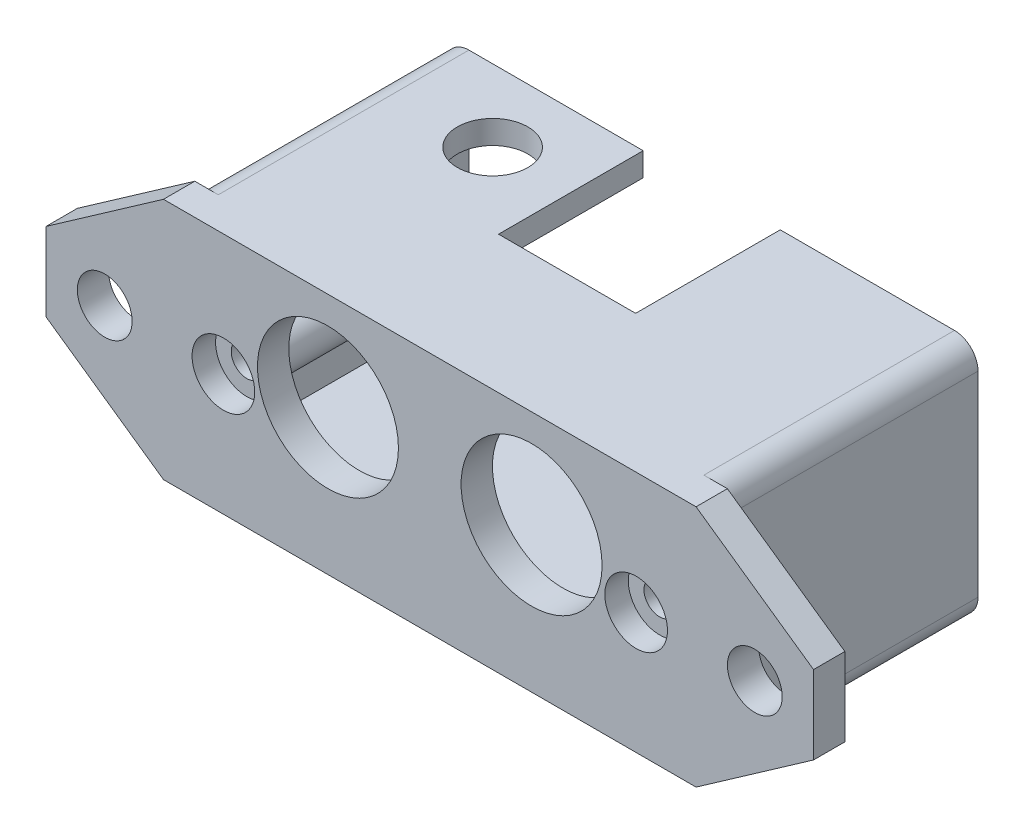
from build123d import *

# Parameters (mm, degrees)
CROQUIS1_R                 = 2
CROQUIS1_R_2               = 3.5
CROQUIS1_R_3               = 9
SALIENTE_EXTRUIR1_DEPTH    = 4
SALIENTE_EXTRUIR2_START    = -12
CROQUIS3_R                 = 3
CROQUIS3_R_2               = 2
SALIENTE_EXTRUIR2_DEPTH    = 12
CROQUIS4_W                 = 62
CROQUIS4_H                 = 25
SALIENTE_EXTRUIR3_DEPTH    = 32
CORTAR_EXTRUIR1_DEPTH      = 10
CORTAR_EXTRUIR1_DEPTH_BACK = 18
CROQUIS5_R                 = 4.5
CROQUIS5_W                 = 17.5
CROQUIS5_H                 = 18.482527597
CORTAR_EXTRUIR2_START      = -3
CROQUIS6_R                 = 4
CROQUIS6_R_2               = 2
CORTAR_EXTRUIR2_DEPTH      = 3


with BuildPart() as part:
    # Croquis1 → Saliente-Extruir1 (new body)
    with BuildSketch(Plane.XY):
        Polygon((-34, 15.5), (34, 15.5), (49, 5), (49, -5), (34, -15.5), (-34, -15.5), (-49, -5), (-49, 5), align=None)
        with Locations((-26.35, 0)):
            Circle(CROQUIS1_R, mode=Mode.SUBTRACT)
        with Locations((26.35, 0)):
            Circle(CROQUIS1_R, mode=Mode.SUBTRACT)
        with Locations((-41.5, 0)):
            Circle(CROQUIS1_R_2, mode=Mode.SUBTRACT)
        with Locations((41.5, 0)):
            Circle(CROQUIS1_R_2, mode=Mode.SUBTRACT)
        with Locations((-13, 3)):
            Circle(CROQUIS1_R_3, mode=Mode.SUBTRACT)
        with Locations((13, 3)):
            Circle(CROQUIS1_R_3, mode=Mode.SUBTRACT)
    extrude(amount=SALIENTE_EXTRUIR1_DEPTH)

    # Croquis3 → Saliente-Extruir2 (add)
    # profile 1 of 2: a face of its own
    with BuildSketch(Plane.XY.offset(SALIENTE_EXTRUIR2_START)):
        with Locations((26.35, 0)):
            Circle(CROQUIS3_R)
        with Locations((26.35, 0)):
            Circle(CROQUIS3_R_2, mode=Mode.SUBTRACT)
    # profile 2 of 2: a face of its own
    with BuildSketch(Plane.XY.offset(SALIENTE_EXTRUIR2_START)):
        with Locations((-26.35, 0)):
            Circle(CROQUIS3_R)
        with Locations((-26.35, 0)):
            Circle(CROQUIS3_R_2, mode=Mode.SUBTRACT)
    extrude(amount=SALIENTE_EXTRUIR2_DEPTH)

    # Croquis4 → Saliente-Extruir3 (add)
    with BuildSketch(Plane.XY):
        with BuildLine():
            Line((31, 15.5), (-31, 15.5))
            ThreePointArc((-31, 15.5), (-33.121320344, 14.621320344), (-34, 12.5))
            Line((-34, 12.5), (-34, -12.5))
            ThreePointArc((-34, -12.5), (-33.121320344, -14.621320344), (-31, -15.5))
            Line((-31, -15.5), (31, -15.5))
            ThreePointArc((31, -15.5), (33.121320344, -14.621320344), (34, -12.5))
            Line((34, -12.5), (34, 12.5))
            ThreePointArc((34, 12.5), (33.121320344, 14.621320344), (31, 15.5))
        make_face()
        Rectangle(CROQUIS4_W, CROQUIS4_H, mode=Mode.SUBTRACT)
    extrude(amount=-SALIENTE_EXTRUIR3_DEPTH)

    # Croquis5 → Cortar-Extruir1 (cut, two sides: drawn at the far end of the back side and taken through both)
    with BuildSketch(Plane(origin=(0, 16, 0), x_dir=(1, 0, 0), z_dir=(0, 1, 0)).offset(-CORTAR_EXTRUIR1_DEPTH_BACK)):
        with Locations((-18.75, 22.773683321)):
            Circle(CROQUIS5_R)
        with Locations((0, 22.77368332)):
            Rectangle(CROQUIS5_W, CROQUIS5_H)
    extrude(amount=CORTAR_EXTRUIR1_DEPTH + CORTAR_EXTRUIR1_DEPTH_BACK, mode=Mode.SUBTRACT)

    # Croquis6 → Cortar-Extruir2 (cut)
    # profile 1 of 2: a face of its own
    with BuildSketch(Plane.XY.offset(4).offset(CORTAR_EXTRUIR2_START)):
        with Locations((26.35, 0)):
            Circle(CROQUIS6_R)
        with Locations((26.35, 0)):
            Circle(CROQUIS6_R_2, mode=Mode.SUBTRACT)
    # profile 2 of 2: a face of its own
    with BuildSketch(Plane.XY.offset(4).offset(CORTAR_EXTRUIR2_START)):
        with Locations((-26.35, 0)):
            Circle(CROQUIS6_R)
        with Locations((-26.35, 0)):
            Circle(CROQUIS6_R_2, mode=Mode.SUBTRACT)
    extrude(amount=CORTAR_EXTRUIR2_DEPTH, mode=Mode.SUBTRACT)


solid = part.part
